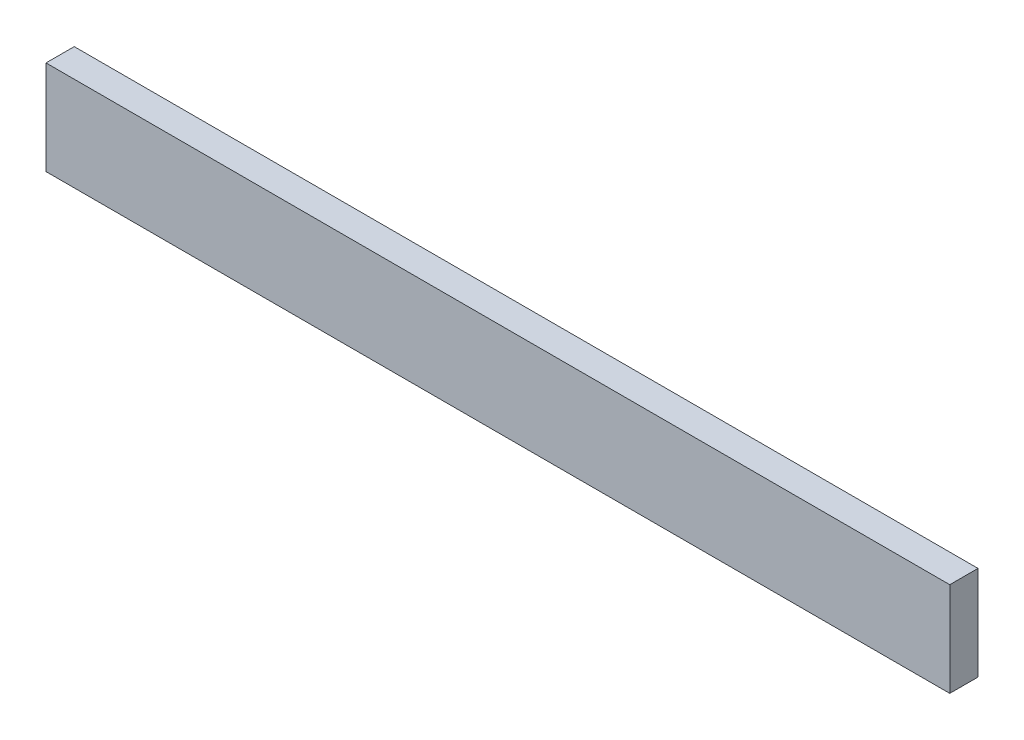
from build123d import *

# Parameters (mm, degrees)
SKETCH1_W           = 96
SKETCH1_H           = 10
BOSS_EXTRUDE1_DEPTH = 3


with BuildPart() as part:
    # Sketch1 → Boss-Extrude1 (new body)
    with BuildSketch(Plane.XY):
        with Locations((-15.149424109, -1.679266012)):
            Rectangle(SKETCH1_W, SKETCH1_H)
    extrude(amount=BOSS_EXTRUDE1_DEPTH)


solid = part.part
